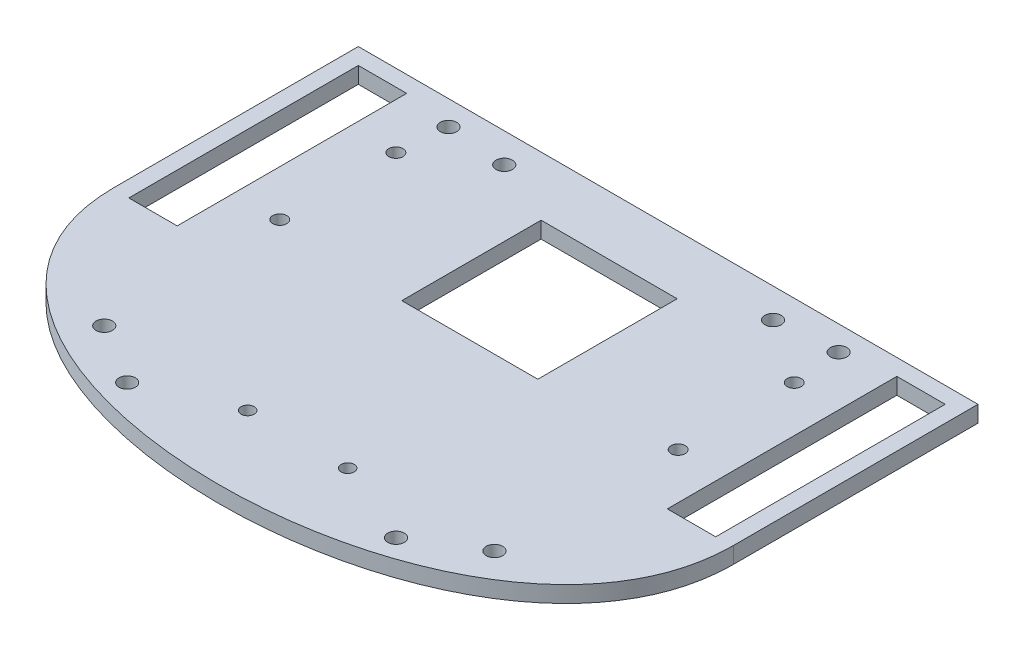
from build123d import *

# Parameters (mm, degrees)
BOSS_EXTRUDE1_DEPTH     = 2.54
CUT_EXTRUDE1_DEPTH      = 60.34583774
CUT_EXTRUDE1_DEPTH_BACK = 60.34583774
SKETCH3_R               = 1.0922
SKETCH3_R_2             = 1.27
SKETCH3_R_3             = 1.016
SKETCH3_W               = 7.493
SKETCH3_H               = 35.56
SKETCH3_W_2             = 21.082
SKETCH3_H_2             = 21.59


with BuildPart() as part:
    # Sketch2 → Boss-Extrude1 (new body)
    with BuildSketch(Plane(origin=(0, 0, 0), x_dir=(1, 0, 0), z_dir=(0, 1, 0))):
        with BuildLine():
            Line((48.006, 34.798), (-48.006, 34.798))
            Line((-48.006, 34.798), (-48.006, -3.048))
            add(Edge.make_bspline(
                [(-48.006, -3.048), (-48.006, -45.381333333), (48.006, -45.381333333), (48.006, -3.048)],
                knots=[0, 0, 0, 0, 1, 1, 1, 1], degree=3))
            Line((48.006, -3.048), (48.006, 34.798))
        make_face()
    extrude(amount=BOSS_EXTRUDE1_DEPTH)

    # Sketch3 → Cut-Extrude1 (cut, two sides: drawn at the far end of the back side and taken through both)
    with BuildSketch(Plane(origin=(0, 2.54, 0), x_dir=(1, 0, 0), z_dir=(0, 1, 0)).offset(-CUT_EXTRUDE1_DEPTH_BACK)):
        with Locations(Location((-30.861, 23.4696, 0), (0, 0, 270))):
            Circle(SKETCH3_R)
        with Locations(Location((-30.861, 5.4864, 0), (0, 0, 270))):
            Circle(SKETCH3_R)
        with Locations(Location((-30.226, 30.988, 0), (0, 0, 270))):
            Circle(SKETCH3_R_2)
        with Locations(Location((30.861, 5.4864, 0), (0, 0, 90))):
            Circle(SKETCH3_R)
        with Locations(Location((30.861, 23.4696, 0), (0, 0, 90))):
            Circle(SKETCH3_R)
        with Locations(Location((-30.226, -22.352, 0), (0, 0, 270))):
            Circle(SKETCH3_R_2)
        with Locations(Location((30.226, -22.352, 0), (0, 0, 90))):
            Circle(SKETCH3_R_2)
        with Locations(Location((30.226, 30.988, 0), (0, 0, 90))):
            Circle(SKETCH3_R_2)
        with Locations(Location((-7.747, -22.606, 0), (0, 0, 270))):
            Circle(SKETCH3_R_3)
        with Locations(Location((7.747, -22.606, 0), (0, 0, 90))):
            Circle(SKETCH3_R_3)
        with Locations(Location((-20.828, 30.226, 0), (0, 0, 270))):
            Circle(SKETCH3_R_2)
        with Locations(Location((-20.828, -28.194, 0), (0, 0, 270))):
            Circle(SKETCH3_R_2)
        with Locations(Location((20.828, -28.194, 0), (0, 0, 90))):
            Circle(SKETCH3_R_2)
        with Locations(Location((20.828, 30.226, 0), (0, 0, 90))):
            Circle(SKETCH3_R_2)
        with Locations((-41.7195, 14.478)):
            Rectangle(SKETCH3_W, SKETCH3_H)
        with Locations((41.7195, 14.478)):
            Rectangle(SKETCH3_W, SKETCH3_H)
        with Locations((0, 14.859)):
            Rectangle(SKETCH3_W_2, SKETCH3_H_2)
    extrude(amount=CUT_EXTRUDE1_DEPTH + CUT_EXTRUDE1_DEPTH_BACK, mode=Mode.SUBTRACT)


solid = part.part
